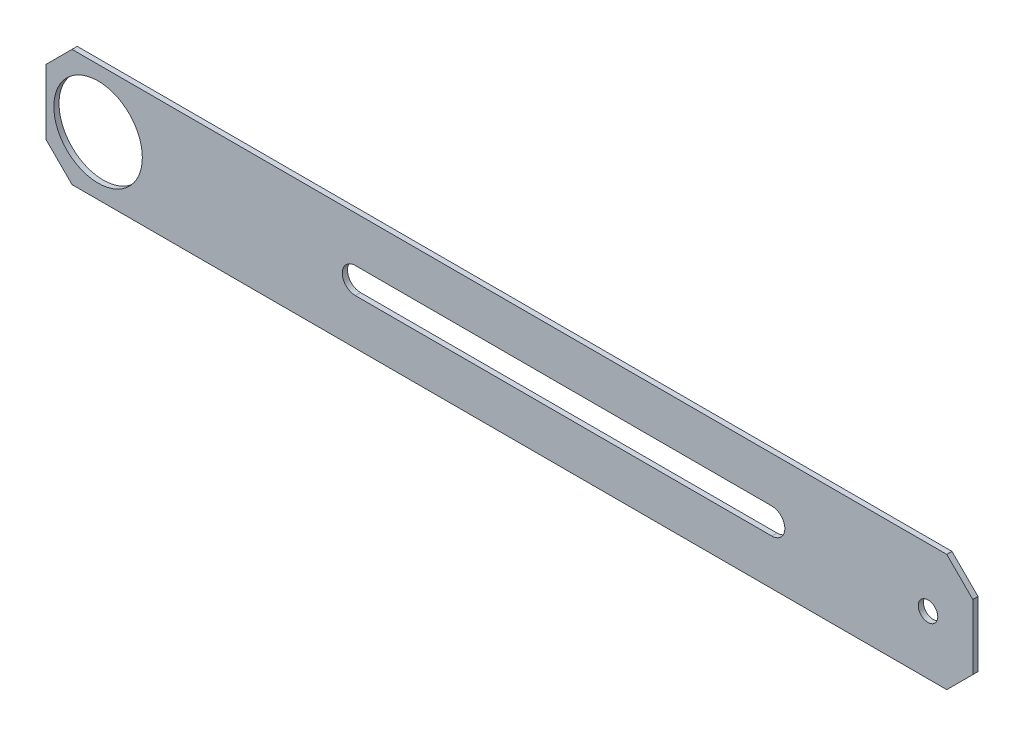
from build123d import *

# Parameters (mm, degrees)
SKETCH1_W           = 904.24
SKETCH1_H           = 114.3
SKETCH1_R           = 43.18
SKETCH1_R_2         = 9.525
BOSS_EXTRUDE1_DEPTH = 5.08
CHAMFER1_SIZE       = 25.4


with BuildPart() as part:
    # Sketch1 → Boss-Extrude1 (new body)
    with BuildSketch(Plane.XY):
        with Locations((452.12, 57.15)):
            Rectangle(SKETCH1_W, SKETCH1_H)
        with Locations((50.8, 57.15)):
            Circle(SKETCH1_R, mode=Mode.SUBTRACT)
        with Locations((860.552, 57.15)):
            Circle(SKETCH1_R_2, mode=Mode.SUBTRACT)
        with BuildLine():
            Line((301.752, 69.85), (708.152, 69.85))
            ThreePointArc((708.152, 69.85), (720.852, 57.15), (708.152, 44.45))
            Line((708.152, 44.45), (301.752, 44.45))
            ThreePointArc((301.752, 44.45), (289.052, 57.15), (301.752, 69.85))
        make_face(mode=Mode.SUBTRACT)
    extrude(amount=BOSS_EXTRUDE1_DEPTH)

    # Chamfer1
    chamfer1_edges = [part.edges().sort_by_distance(p)[0] for p in [
        (0, 114.3, 2.54),
        (904.24, 114.3, 2.54),
        (904.24, 0, 2.54),
        (0, 0, 2.54),
    ]]
    chamfer(chamfer1_edges, length=CHAMFER1_SIZE)


solid = part.part
